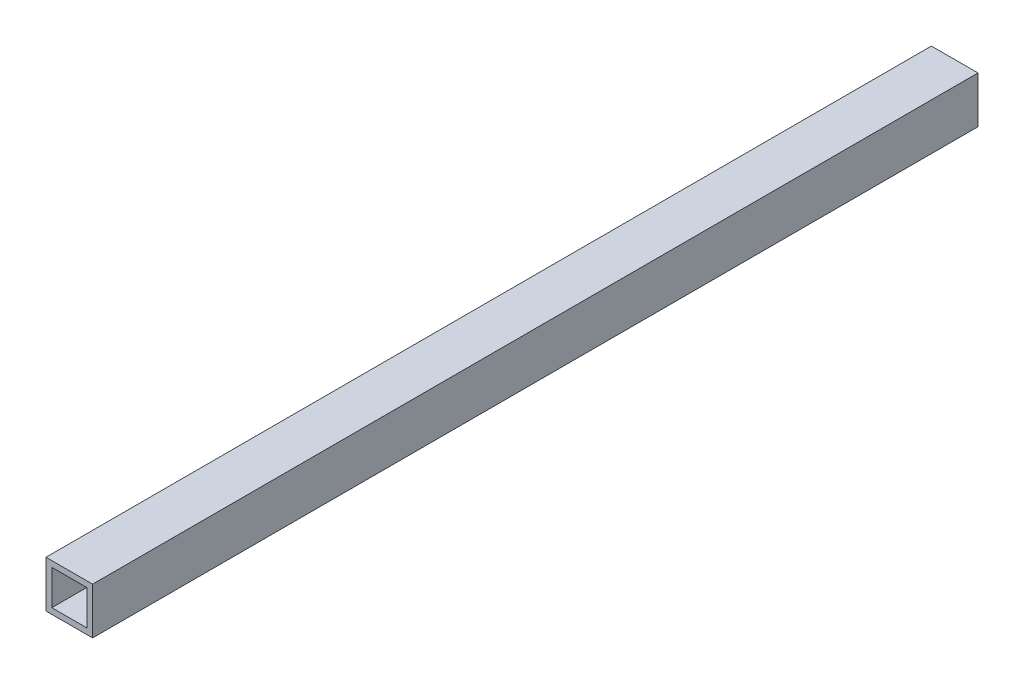
from build123d import *

# Parameters (mm, degrees)
SKETCH1_W           = 25.4
SKETCH1_H           = 25.4
SKETCH1_W_2         = 19.05
SKETCH1_H_2         = 19.05
BOSS_EXTRUDE1_DEPTH = 482.6


with BuildPart() as part:
    # Sketch1 → Boss-Extrude1 (new body)
    with BuildSketch(Plane.XY):
        with Locations((12.7, 12.7)):
            Rectangle(SKETCH1_W, SKETCH1_H)
        with Locations((12.7, 12.7)):
            Rectangle(SKETCH1_W_2, SKETCH1_H_2, mode=Mode.SUBTRACT)
    extrude(amount=BOSS_EXTRUDE1_DEPTH)


solid = part.part
